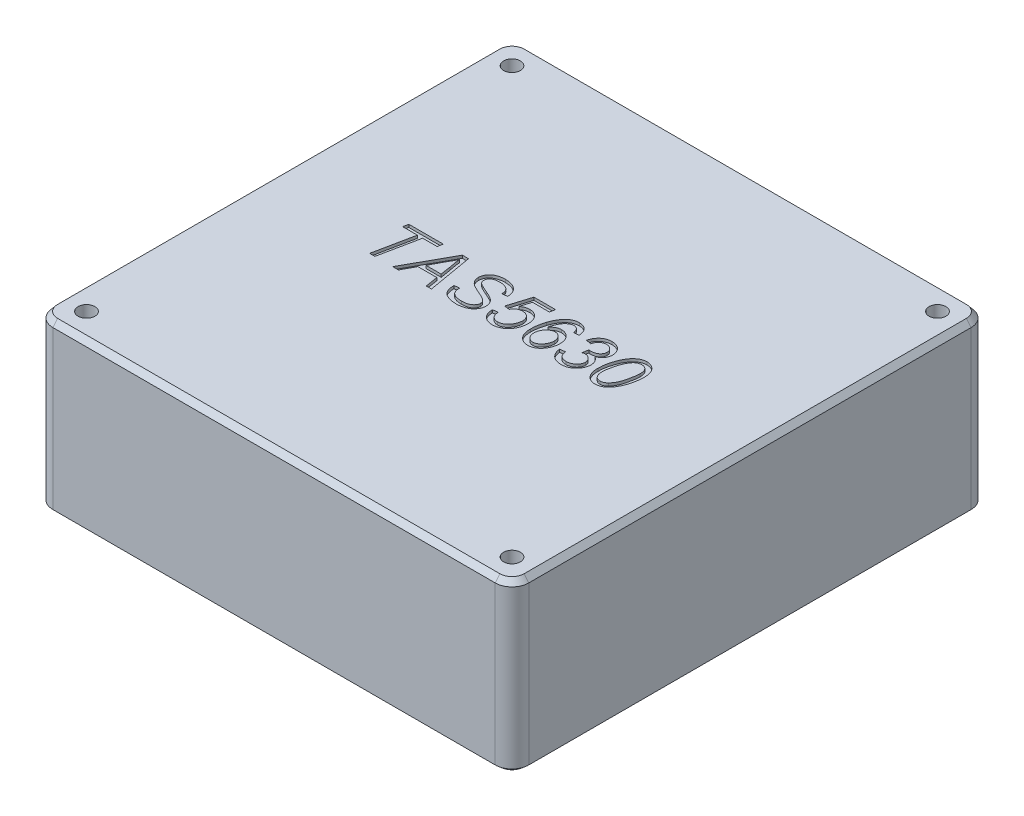
from build123d import *
from OCP.BRepFilletAPI import BRepFilletAPI_MakeChamfer

# Parameters (mm, degrees)
SKETCH_1_W          = 85
SKETCH_1_H          = 85
SKETCH_1_R          = 1.5
EXTRUDE_1_DEPTH     = 30
CUT_EXTRUDE_START   = 30
CUT_EXTRUDE_1_DEPTH = 0.5
FILLET_1_R          = 3
CHAMFER_1_SIZE      = 1
CHAMFER_1_SIZE2     = 0.839099631


with BuildPart() as part:
    # Эскиз1 → Бобышка-Вытянуть1 (new body)
    with BuildSketch(Plane(origin=(0, 0, 0), x_dir=(1, 0, 0), z_dir=(0, 1, 0))):
        Rectangle(SKETCH_1_W, SKETCH_1_H)
        with Locations(Location((-38, 38, 0), (0, 0, 270))):
            Circle(SKETCH_1_R, mode=Mode.SUBTRACT)
        with Locations(Location((-38, -38, 0), (0, 0, 270))):
            Circle(SKETCH_1_R, mode=Mode.SUBTRACT)
        with Locations(Location((38, -38, 0), (0, 0, 270))):
            Circle(SKETCH_1_R, mode=Mode.SUBTRACT)
        with Locations(Location((38, 38, 0), (0, 0, 270))):
            Circle(SKETCH_1_R, mode=Mode.SUBTRACT)
    extrude(amount=EXTRUDE_1_DEPTH)

    # Эскиз2 → Вырез-Вытянуть1 (cut)
    # profile 1 of 7: a face of its own
    with BuildSketch(Plane(origin=(0, 0, 0), x_dir=(1, 0, 0), z_dir=(0, 1, 0)).offset(CUT_EXTRUDE_START)):
        Polygon((-21.692433963, -3.73177485), (-20.245318578, 3.345148227), (-22.876728835, 3.345148227), (-22.687626271, 4.26822515), (-16.536985245, 4.26822515), (-16.727690373, 3.345148227), (-19.306216014, 3.345148227), (-20.753331399, -3.73177485), align=None)
    # profile 2 of 7: a face of its own
    with BuildSketch(Plane(origin=(0, 0, 0), x_dir=(1, 0, 0), z_dir=(0, 1, 0)).offset(CUT_EXTRUDE_START)):
        Polygon((-17.578651912, -3.73177485), (-13.137946783, 4.26822515), (-12.036985245, 4.26822515), (-10.657177553, -3.73177485), (-11.58986986, -3.73177485), (-11.950446783, -1.475364594), (-15.325446783, -1.475364594), (-16.544998065, -3.73177485), align=None)
        with BuildLine():
            Line((-14.798203194, -0.552287671), (-12.096280117, -0.552287671))
            Line((-12.096280117, -0.552287671), (-12.403972424, 1.37399438))
            add(Edge.make_bspline(
                [(-12.403972424, 1.37399438), (-12.424786211, 1.470580235), (-12.465420433, 1.659142325), (-12.516328002, 1.937092947), (-12.568392425, 2.201347782), (-12.608031686, 2.454032483), (-12.647325874, 2.693944928), (-12.673630929, 2.92208113), (-12.701860341, 3.137460723), (-12.712773744, 3.277246523), (-12.718074988, 3.345148227)],
                knots=[0, 0, 0, 0, 1.187075157, 2.317496411, 3.39507795, 4.42283965, 5.390522706, 6.315610667, 7.18179882, 8, 8, 8, 8], degree=3))
            add(Edge.make_bspline(
                [(-12.718074988, 3.345148227), (-12.772104137, 3.22714588), (-12.886019797, 2.978348416), (-13.086977698, 2.595261344), (-13.32085901, 2.181061113), (-13.492420184, 1.897051782), (-13.58185704, 1.74899438)],
                knots=[0, 0, 0, 0, 0.85739934, 1.807750339, 2.857154497, 4, 4, 4, 4], degree=3))
            Line((-13.58185704, 1.74899438), (-14.798203194, -0.552287671))
        make_face(mode=Mode.SUBTRACT)
    # profile 3 of 7: a face of its own
    with BuildSketch(Plane(origin=(0, 0, 0), x_dir=(1, 0, 0), z_dir=(0, 1, 0)).offset(CUT_EXTRUDE_START)):
        with BuildLine():
            Line((-9.17961345, -1.167672286), (-8.256536527, -1.065108184))
            Line((-8.256536527, -1.065108184), (-8.267754476, -1.331133825))
            add(Edge.make_bspline(
                [(-8.267754476, -1.331133825), (-8.26490623, -1.40344325), (-8.259267109, -1.546605668), (-8.216634657, -1.756013562), (-8.146374843, -1.95562868), (-8.051278453, -2.146028766), (-7.921849914, -2.322387836), (-7.75244273, -2.475728252), (-7.548663888, -2.609195471), (-7.309775221, -2.718095952), (-7.042645916, -2.805640766), (-6.749247025, -2.867274022), (-6.432157728, -2.904110478), (-6.212836102, -2.908825295), (-6.099485245, -2.91126203)],
                knots=[0, 0, 0, 0, 0.858275681, 1.699264264, 2.525822281, 3.365565876, 4.218149606, 5.107011874, 6.064126396, 7.09998594, 8.215326971, 9.396056326, 10.654217318, 12, 12, 12, 12], degree=3))
            add(Edge.make_bspline(
                [(-6.099485245, -2.91126203), (-6.018782176, -2.91010858), (-5.861942354, -2.907866944), (-5.633917733, -2.888352374), (-5.420720033, -2.856961826), (-5.222335603, -2.812337484), (-5.039276373, -2.754293148), (-4.86938773, -2.686136802), (-4.715035335, -2.602849546), (-4.577232482, -2.505891029), (-4.454784366, -2.402019461), (-4.345784586, -2.295184608), (-4.256490691, -2.182247001), (-4.180902729, -2.067650349), (-4.122801816, -1.948046175), (-4.080956386, -1.824855464), (-4.055903232, -1.6975304), (-4.052917317, -1.611693025), (-4.051408322, -1.568313312)],
                knots=[0, 0, 0, 0, 1.425731279, 2.770792289, 4.04024254, 5.230893421, 6.3592722, 7.430212247, 8.460708778, 9.450459374, 10.401561135, 11.295891975, 12.14200498, 12.940503131, 13.717227411, 14.484314755, 15.234016756, 16, 16, 16, 16], degree=3))
            add(Edge.make_bspline(
                [(-4.051408322, -1.568313312), (-4.054760166, -1.508068195), (-4.061409828, -1.388549044), (-4.116632341, -1.214936965), (-4.201552611, -1.048011507), (-4.283269801, -0.950416261), (-4.325446783, -0.900044081)],
                knots=[0, 0, 0, 0, 0.976847459, 1.937949255, 2.935706458, 4, 4, 4, 4], degree=3))
            add(Edge.make_bspline(
                [(-4.325446783, -0.900044081), (-4.353237787, -0.873261871), (-4.415680758, -0.813085537), (-4.532812341, -0.728179073), (-4.679126919, -0.635537122), (-4.85600845, -0.536719863), (-5.06270673, -0.431673636), (-5.299607068, -0.319307817), (-5.566225693, -0.199621651), (-5.755302653, -0.11974678), (-5.854292937, -0.077928696)],
                knots=[0, 0, 0, 0, 0.53058602, 1.192161577, 1.98540538, 2.9135926, 3.978754358, 5.17558752, 6.521293165, 8, 8, 8, 8], degree=3))
            add(Edge.make_bspline(
                [(-5.854292937, -0.077928696), (-5.931872122, -0.045626286), (-6.081007909, 0.016470852), (-6.293992177, 0.110486968), (-6.489468199, 0.195314098), (-6.66357543, 0.278394714), (-6.820103327, 0.350985617), (-6.955811569, 0.42044299), (-7.073723214, 0.48193986), (-7.144000057, 0.524321721), (-7.176408322, 0.543866175)],
                knots=[0, 0, 0, 0, 1.379339666, 2.651599208, 3.821445283, 4.876640935, 5.817965058, 6.653218182, 7.378929685, 8, 8, 8, 8], degree=3))
            add(Edge.make_bspline(
                [(-7.176408322, 0.543866175), (-7.264432037, 0.601715282), (-7.433607392, 0.712897173), (-7.654232402, 0.905215341), (-7.845968548, 1.097511681), (-7.996836056, 1.30458034), (-8.114644725, 1.521453508), (-8.19671198, 1.752842503), (-8.248265879, 1.99831358), (-8.253743975, 2.167537377), (-8.256536527, 2.253802073)],
                knots=[0, 0, 0, 0, 1.190296613, 2.28766591, 3.304920813, 4.256269293, 5.175634749, 6.087520294, 7.025081087, 8, 8, 8, 8], degree=3))
            add(Edge.make_bspline(
                [(-8.256536527, 2.253802073), (-8.252534553, 2.353474802), (-8.244646951, 2.549922564), (-8.181834848, 2.837029075), (-8.078514464, 3.108591872), (-7.958783554, 3.320339048), (-7.844825334, 3.479353008), (-7.748416104, 3.59210024), (-7.641079011, 3.696280567), (-7.527059063, 3.796385397), (-7.400535341, 3.885128002), (-7.267366019, 3.970105015), (-7.122711694, 4.04400481), (-6.918123425, 4.137378564), (-6.643970023, 4.231599522), (-6.296731656, 4.313380342), (-5.928856121, 4.362061196), (-5.677089881, 4.367833987), (-5.548203194, 4.370789252)],
                knots=[0, 0, 0, 0, 1.238475896, 2.440946701, 3.635078099, 4.839601842, 5.453463916, 6.065850834, 6.681148677, 7.312269075, 7.950065238, 8.600634686, 9.275045789, 9.967691431, 11.396165333, 12.870345012, 14.397835766, 16, 16, 16, 16], degree=3))
            add(Edge.make_bspline(
                [(-5.548203194, 4.370789252), (-5.470711169, 4.370081603), (-5.319290555, 4.368698846), (-5.096880246, 4.351566096), (-4.883275647, 4.32686673), (-4.678988934, 4.289811004), (-4.483408201, 4.24366093), (-4.29789283, 4.185652412), (-4.120660162, 4.118982996), (-3.95428585, 4.039780318), (-3.797539912, 3.953539252), (-3.650732343, 3.860762731), (-3.516146353, 3.759492052), (-3.392316073, 3.651973478), (-3.279127055, 3.537871959), (-3.178357108, 3.41573479), (-3.088000097, 3.28729107), (-2.98556536, 3.109561245), (-2.881046428, 2.885623491), (-2.788471013, 2.617215987), (-2.728081934, 2.354784858), (-2.721360237, 2.180386113), (-2.718074988, 2.095148227)],
                knots=[0, 0, 0, 0, 1.143512507, 2.234441106, 3.290654609, 4.316047515, 5.297102877, 6.254749841, 7.183126598, 8.089581974, 8.971812638, 9.822656227, 10.650539834, 11.455310542, 12.241441721, 13.019784509, 13.789735541, 14.55649065, 16.045011508, 17.428866519, 18.743351145, 20, 20, 20, 20], degree=3))
            add(Edge.make_bspline(
                [(-2.718074988, 2.095148227), (-2.718074988, 2.072712329), (-2.718074988, 2.017156774), (-2.718074988, 1.961601218), (-2.718074988, 1.92848156)],
                knots=[0, 0, 0, 0, 0.807692308, 2, 2, 2, 2], degree=3))
            Line((-2.718074988, 1.92848156), (-3.641151912, 1.845148227))
            add(Edge.make_bspline(
                [(-3.641151912, 1.845148227), (-3.641547466, 1.898596315), (-3.64229608, 1.999750567), (-3.653559046, 2.142104068), (-3.670999795, 2.266400925), (-3.692223231, 2.341040158), (-3.702049347, 2.375596945)],
                knots=[0, 0, 0, 0, 1.196373472, 2.264220624, 3.196361544, 4, 4, 4, 4], degree=3))
            add(Edge.make_bspline(
                [(-3.702049347, 2.375596945), (-3.721577709, 2.429568872), (-3.760070316, 2.535953642), (-3.839475609, 2.683720998), (-3.933852598, 2.817976409), (-4.041500799, 2.942239515), (-4.171045548, 3.051663484), (-4.319045599, 3.152142703), (-4.490967686, 3.237912627), (-4.68193599, 3.312262626), (-4.889802758, 3.373413909), (-5.111545803, 3.41526658), (-5.344977617, 3.444353543), (-5.504839372, 3.446575182), (-5.586664732, 3.447712329)],
                knots=[0, 0, 0, 0, 0.88689608, 1.748172411, 2.584840347, 3.421997753, 4.283274084, 5.199961756, 6.182923366, 7.247800225, 8.366915099, 9.5288022, 10.735115532, 12, 12, 12, 12], degree=3))
            add(Edge.make_bspline(
                [(-5.586664732, 3.447712329), (-5.658277679, 3.446391193), (-5.797454199, 3.443823626), (-5.999951885, 3.426596834), (-6.189945472, 3.395843656), (-6.367910553, 3.354661304), (-6.534436486, 3.301917028), (-6.68863607, 3.236322961), (-6.830758484, 3.158188168), (-6.916334005, 3.095539221), (-6.958459604, 3.064699509)],
                knots=[0, 0, 0, 0, 1.185078943, 2.303147281, 3.3596952, 4.367486573, 5.323590023, 6.246379327, 7.136758724, 8, 8, 8, 8], degree=3))
            add(Edge.make_bspline(
                [(-6.958459604, 3.064699509), (-6.988564248, 3.040361592), (-7.047528416, 2.992692367), (-7.122666983, 2.908811907), (-7.189966932, 2.82194049), (-7.240025415, 2.725398363), (-7.283448743, 2.625949975), (-7.311430036, 2.518894439), (-7.329608386, 2.406667185), (-7.332162556, 2.329730646), (-7.333459604, 2.290661047)],
                knots=[0, 0, 0, 0, 1.039030166, 2.035086348, 3.020315512, 3.984274806, 4.949837582, 5.932341348, 6.950010026, 8, 8, 8, 8], degree=3))
            add(Edge.make_bspline(
                [(-7.333459604, 2.290661047), (-7.331710899, 2.244026582), (-7.328278745, 2.152497906), (-7.298121919, 2.019032969), (-7.249897337, 1.893086094), (-7.181069572, 1.772464556), (-7.084232684, 1.6575501), (-6.957642626, 1.546274419), (-6.801104114, 1.435482962), (-6.682976237, 1.369126973), (-6.620318578, 1.333930278)],
                knots=[0, 0, 0, 0, 0.885166844, 1.737301987, 2.585559362, 3.440410528, 4.36313212, 5.426921844, 6.635181999, 8, 8, 8, 8], degree=3))
            add(Edge.make_bspline(
                [(-6.620318578, 1.333930278), (-6.592012538, 1.319497105), (-6.527526866, 1.286616037), (-6.419245151, 1.231745942), (-6.284801112, 1.170031542), (-6.127105484, 1.095281331), (-5.942472228, 1.015591422), (-5.736021783, 0.920680336), (-5.502643808, 0.820922019), (-5.339285712, 0.749641275), (-5.253331399, 0.712135406)],
                knots=[0, 0, 0, 0, 0.507694923, 1.156609942, 1.939357829, 2.871124938, 3.94489054, 5.152129338, 6.501532703, 8, 8, 8, 8], degree=3))
            add(Edge.make_bspline(
                [(-5.253331399, 0.712135406), (-5.183352539, 0.681153495), (-5.048651902, 0.621517152), (-4.854730771, 0.535644452), (-4.678371946, 0.454008343), (-4.519324065, 0.376749364), (-4.376853902, 0.305291191), (-4.251445851, 0.237653536), (-4.142827988, 0.175877615), (-4.076937502, 0.134864537), (-4.04660063, 0.11598156)],
                knots=[0, 0, 0, 0, 1.363402043, 2.62438005, 3.778247165, 4.825290736, 5.77437896, 6.617445503, 7.363453188, 8, 8, 8, 8], degree=3))
            add(Edge.make_bspline(
                [(-4.04660063, 0.11598156), (-3.975880755, 0.067415447), (-3.837135828, -0.027866139), (-3.654179957, -0.196495497), (-3.494986103, -0.378483297), (-3.362866857, -0.576656247), (-3.257911376, -0.789318411), (-3.181889232, -1.016028824), (-3.13579428, -1.25714767), (-3.130854354, -1.422808401), (-3.128331399, -1.507415876)],
                knots=[0, 0, 0, 0, 1.054714124, 2.069237773, 3.052629045, 4.024524991, 4.991873927, 5.962790947, 6.959541516, 8, 8, 8, 8], degree=3))
            add(Edge.make_bspline(
                [(-3.128331399, -1.507415876), (-3.129672892, -1.560878367), (-3.132322928, -1.666490158), (-3.150203377, -1.823615064), (-3.180937059, -1.976677875), (-3.222131786, -2.127846941), (-3.279549988, -2.274156518), (-3.344555221, -2.419603832), (-3.423711805, -2.560927532), (-3.514762773, -2.697653485), (-3.615833689, -2.829961437), (-3.727947405, -2.954135104), (-3.848391387, -3.071363668), (-3.977249563, -3.181534591), (-4.116953136, -3.282232616), (-4.266515512, -3.374592836), (-4.42371247, -3.46194146), (-4.647428219, -3.56682495), (-4.946408429, -3.675871188), (-5.327934674, -3.768469268), (-5.734652752, -3.823198), (-6.013845248, -3.830559628), (-6.157177553, -3.834338953)],
                knots=[0, 0, 0, 0, 0.753323331, 1.488142895, 2.22477222, 2.951645461, 3.692569589, 4.437003057, 5.195162042, 5.9717794, 6.750145735, 7.539032231, 8.32684067, 9.11716229, 9.925698599, 10.750710093, 11.592951182, 12.45831893, 14.230046657, 16.066640586, 17.980685438, 20, 20, 20, 20], degree=3))
            add(Edge.make_bspline(
                [(-6.157177553, -3.834338953), (-6.265682016, -3.832486939), (-6.477700105, -3.828868098), (-6.788074025, -3.80078374), (-7.083955018, -3.757214261), (-7.364097135, -3.692069974), (-7.630578695, -3.613868076), (-7.879179093, -3.510967767), (-8.114515056, -3.39477971), (-8.334068341, -3.259151795), (-8.533394745, -3.098683653), (-8.707330322, -2.908376887), (-8.853862464, -2.688311308), (-8.971959147, -2.438934065), (-9.065190558, -2.161915191), (-9.131530021, -1.856176814), (-9.171351831, -1.52128059), (-9.176790165, -1.28851263), (-9.17961345, -1.167672286)],
                knots=[0, 0, 0, 0, 1.125067994, 2.198386657, 3.229442192, 4.223907366, 5.179018808, 6.105903256, 7.010179201, 7.898637484, 8.776811776, 9.655143314, 10.561656395, 11.508166035, 12.508477435, 13.586446658, 14.74701564, 16, 16, 16, 16], degree=3))
        make_face()
    # profile 4 of 7: a face of its own
    with BuildSketch(Plane(origin=(0, 0, 0), x_dir=(1, 0, 0), z_dir=(0, 1, 0)).offset(CUT_EXTRUDE_START)):
        with BuildLine():
            Line((-1.995318578, -1.475364594), (-1.065831399, -1.372800491))
            add(Edge.make_bspline(
                [(-1.065831399, -1.372800491), (-1.067603031, -1.401104381), (-1.070744608, -1.451294733), (-1.072785308, -1.517616579), (-1.077553546, -1.565055073), (-1.077186717, -1.590744431), (-1.077049347, -1.600364594)],
                knots=[0, 0, 0, 0, 1.49324247, 2.647917546, 3.493671534, 4, 4, 4, 4], degree=3))
            add(Edge.make_bspline(
                [(-1.077049347, -1.600364594), (-1.075140838, -1.654013751), (-1.071278771, -1.762578422), (-1.030951524, -1.924378949), (-0.971939547, -2.087195656), (-0.889037798, -2.24714482), (-0.786572823, -2.398082923), (-0.664674475, -2.532807508), (-0.526451029, -2.649752238), (-0.369933963, -2.7428498), (-0.204558914, -2.818502114), (-0.031962092, -2.870894121), (0.144921983, -2.904750629), (0.26467641, -2.909076137), (0.325194242, -2.91126203)],
                knots=[0, 0, 0, 0, 0.906627297, 1.834654978, 2.807478465, 3.834894577, 4.87595349, 5.887685388, 6.902081762, 7.928900597, 8.961082484, 9.973784094, 10.976052945, 12, 12, 12, 12], degree=3))
            add(Edge.make_bspline(
                [(0.325194242, -2.91126203), (0.405683949, -2.907591997), (0.569331284, -2.900130284), (0.813701678, -2.836500888), (1.059705696, -2.737342402), (1.304806075, -2.599908042), (1.541163337, -2.425468148), (1.755753549, -2.211148562), (1.946434661, -1.961605196), (2.10755143, -1.680794413), (2.2404737, -1.3849168), (2.338058194, -1.084246564), (2.398693688, -0.784431173), (2.406345637, -0.584073121), (2.41013014, -0.484979979)],
                knots=[0, 0, 0, 0, 0.823456648, 1.674207695, 2.570467732, 3.535691777, 4.544780077, 5.570191462, 6.631860066, 7.75250498, 8.879305647, 9.948786735, 10.985510363, 12, 12, 12, 12], degree=3))
            add(Edge.make_bspline(
                [(2.41013014, -0.484979979), (2.40897357, -0.430433627), (2.406720837, -0.324189749), (2.387028759, -0.169147836), (2.355045686, -0.022688851), (2.310695586, 0.116430666), (2.25018837, 0.246015897), (2.180608735, 0.369455084), (2.094070433, 0.481319232), (1.998168547, 0.58604852), (1.891269489, 0.680095496), (1.775282545, 0.762316812), (1.651203468, 0.831761552), (1.518666416, 0.887407019), (1.379145573, 0.933447953), (1.229976549, 0.962585363), (1.073610484, 0.982772255), (0.966288128, 0.985027469), (0.911732704, 0.986173868)],
                knots=[0, 0, 0, 0, 1.106111206, 2.154452896, 3.164053986, 4.144088983, 5.109031686, 6.06061856, 7.012020331, 7.970553412, 8.937926705, 9.894006722, 10.849656805, 11.815754801, 12.806099026, 13.824039282, 14.893888794, 16, 16, 16, 16], degree=3))
            add(Edge.make_bspline(
                [(0.911732704, 0.986173868), (0.837320451, 0.983167867), (0.690087349, 0.977220152), (0.47135249, 0.936426331), (0.260563357, 0.864579457), (0.055791846, 0.769625111), (-0.134790703, 0.643672612), (-0.301949009, 0.481270065), (-0.44678861, 0.287253831), (-0.519039676, 0.139250924), (-0.556216014, 0.063096945)],
                knots=[0, 0, 0, 0, 0.97081602, 1.920869877, 2.890634552, 3.869597423, 4.85931845, 5.855033763, 6.89632091, 8, 8, 8, 8], degree=3))
            Line((-0.556216014, 0.063096945), (-1.487305758, 0.165661047))
            Line((-1.487305758, 0.165661047), (-0.251728835, 4.165661047))
            Line((-0.251728835, 4.165661047), (3.615258345, 4.165661047))
            Line((3.615258345, 4.165661047), (3.424553217, 3.242584124))
            Line((3.424553217, 3.242584124), (0.424553217, 3.242584124))
            Line((0.424553217, 3.242584124), (-0.150767296, 1.382007201))
            add(Edge.make_bspline(
                [(-0.150767296, 1.382007201), (-0.095308903, 1.424043474), (0.013920489, 1.506837011), (0.186009269, 1.613528875), (0.358923174, 1.705922098), (0.535008756, 1.780020092), (0.713514, 1.838019164), (0.894646797, 1.879976206), (1.078252572, 1.904542326), (1.201191238, 1.907680729), (1.262694242, 1.909250791)],
                knots=[0, 0, 0, 0, 1.08549606, 2.137964479, 3.156027519, 4.142328905, 5.115149779, 6.081807146, 7.040378209, 8, 8, 8, 8], degree=3))
            add(Edge.make_bspline(
                [(1.262694242, 1.909250791), (1.336491709, 1.907407776), (1.481464095, 1.903787243), (1.69388443, 1.87519425), (1.895573025, 1.823901364), (2.08865143, 1.758599865), (2.269629101, 1.667845856), (2.442347854, 1.561360068), (2.602193189, 1.431165847), (2.753550239, 1.286287943), (2.888799006, 1.122928321), (3.008904944, 0.945220408), (3.110080199, 0.752316077), (3.191083806, 0.544478798), (3.256341546, 0.323264737), (3.299643153, 0.087426926), (3.327843792, -0.162717548), (3.331385549, -0.334257531), (3.333207063, -0.422479979)],
                knots=[0, 0, 0, 0, 1.009083946, 1.982307972, 2.923133173, 3.851912484, 4.763437245, 5.685700749, 6.62123574, 7.577002532, 8.546958346, 9.51545502, 10.505559142, 11.51891788, 12.561530472, 13.654716952, 14.793828665, 16, 16, 16, 16], degree=3))
            add(Edge.make_bspline(
                [(3.333207063, -0.422479979), (3.331983796, -0.501042439), (3.329558518, -0.656802227), (3.309914678, -0.887997704), (3.277320069, -1.114095989), (3.235246768, -1.336146162), (3.176226318, -1.55229163), (3.108046947, -1.765360887), (3.024256705, -1.972503954), (2.930159196, -2.174503599), (2.824813572, -2.3678024), (2.709221579, -2.550877518), (2.584667554, -2.722829326), (2.448604809, -2.88197254), (2.305231771, -3.031496603), (2.150326229, -3.167962244), (1.98652935, -3.293358756), (1.813946865, -3.406685106), (1.63545035, -3.506956674), (1.452965893, -3.594440791), (1.26699698, -3.667799965), (1.077320044, -3.729726008), (0.883597211, -3.775348843), (0.686699558, -3.809282403), (0.486477588, -3.831095851), (0.351424952, -3.833253966), (0.283527576, -3.834338953)],
                knots=[0, 0, 0, 0, 1.107778984, 2.196308754, 3.269111178, 4.328392579, 5.380902249, 6.426704866, 7.481449709, 8.529528877, 9.567816257, 10.583531577, 11.581009243, 12.559068588, 13.533989767, 14.499905363, 15.467200609, 16.440840376, 17.408868676, 18.35231528, 19.292357287, 20.226221515, 21.16354305, 22.096099876, 23.042818958, 24, 24, 24, 24], degree=3))
            add(Edge.make_bspline(
                [(0.283527576, -3.834338953), (0.17163825, -3.830694377), (-0.047191569, -3.823566425), (-0.365677694, -3.766269696), (-0.664792217, -3.672153088), (-0.940184623, -3.538439367), (-1.190572658, -3.373812573), (-1.407676065, -3.176656636), (-1.594435378, -2.952891259), (-1.740611618, -2.701390425), (-1.854214172, -2.437228292), (-1.938802707, -2.170116171), (-1.991017614, -1.902086561), (-1.997105605, -1.722916745), (-2.000126271, -1.63401844)],
                knots=[0, 0, 0, 0, 1.134559216, 2.218937215, 3.271314431, 4.306342073, 5.314938747, 6.301080251, 7.271171215, 8.260123367, 9.240754197, 10.183513153, 11.098717604, 12, 12, 12, 12], degree=3))
            add(Edge.make_bspline(
                [(-2.000126271, -1.63401844), (-1.9996378, -1.612115385), (-1.998458116, -1.559218322), (-1.996478497, -1.506344805), (-1.995318578, -1.475364594)],
                knots=[0, 0, 0, 0, 0.828138796, 2, 2, 2, 2], degree=3))
        make_face()
    # profile 5 of 7: a face of its own
    with BuildSketch(Plane(origin=(0, 0, 0), x_dir=(1, 0, 0), z_dir=(0, 1, 0)).offset(CUT_EXTRUDE_START)):
        with BuildLine():
            add(Edge.make_bspline(
                [(5.618463473, 0.798673868), (5.684737247, 0.862871641), (5.813546539, 0.987646032), (6.01762152, 1.149696), (6.218551403, 1.290463766), (6.421484454, 1.40264113), (6.623372006, 1.491953122), (6.824885642, 1.555009783), (7.025636324, 1.593644038), (7.159433115, 1.598933413), (7.225835268, 1.601558483)],
                knots=[0, 0, 0, 0, 1.200695668, 2.333664572, 3.388991219, 4.391540616, 5.347781268, 6.258546035, 7.135731947, 8, 8, 8, 8], degree=3))
            add(Edge.make_bspline(
                [(7.225835268, 1.601558483), (7.298586759, 1.599793479), (7.441475344, 1.596326897), (7.650801297, 1.566587952), (7.85141759, 1.518954463), (8.041327328, 1.449856861), (8.222273826, 1.362514091), (8.391683493, 1.254249938), (8.553707347, 1.128736761), (8.703181301, 0.983262401), (8.839177519, 0.821801387), (8.95859623, 0.646579173), (9.058534606, 0.457163067), (9.139910991, 0.254537435), (9.204820015, 0.038545027), (9.248422351, -0.191366745), (9.276433618, -0.434076545), (9.280066675, -0.600284084), (9.281925012, -0.685300491)],
                knots=[0, 0, 0, 0, 1.009933029, 1.983573098, 2.930039649, 3.86874025, 4.784499183, 5.714807186, 6.655674675, 7.626285778, 8.605618543, 9.583010502, 10.56534534, 11.573778596, 12.611238794, 13.692267209, 14.819577305, 16, 16, 16, 16], degree=3))
            add(Edge.make_bspline(
                [(9.281925012, -0.685300491), (9.279819632, -0.796020554), (9.275664482, -1.014536209), (9.231997816, -1.335622029), (9.165113961, -1.644497899), (9.072405751, -1.941889826), (8.949173016, -2.226028506), (8.801691929, -2.499602563), (8.626473286, -2.761341947), (8.490240037, -2.922642491), (8.421348088, -3.004210748)],
                knots=[0, 0, 0, 0, 1.049391632, 2.071065482, 3.06668699, 4.04399474, 5.01979151, 5.998987983, 6.988105935, 8, 8, 8, 8], degree=3))
            add(Edge.make_bspline(
                [(8.421348088, -3.004210748), (8.358940331, -3.070034421), (8.236264358, -3.199425118), (8.035171086, -3.37023806), (7.822918809, -3.513883369), (7.599716768, -3.629573357), (7.368029964, -3.721891252), (7.126273237, -3.787895668), (6.874033319, -3.827225468), (6.702471628, -3.83194154), (6.615258345, -3.834338953)],
                knots=[0, 0, 0, 0, 1.060809501, 2.085251007, 3.080363607, 4.053300922, 5.021346797, 5.993339951, 6.979915562, 8, 8, 8, 8], degree=3))
            add(Edge.make_bspline(
                [(6.615258345, -3.834338953), (6.536066797, -3.832298604), (6.380682242, -3.828295164), (6.153008445, -3.793334817), (5.934876791, -3.738075294), (5.727751364, -3.6563425), (5.528684806, -3.556123661), (5.34269661, -3.429006886), (5.164714407, -3.282456323), (4.998684885, -3.113184644), (4.848406849, -2.922402694), (4.715376835, -2.712581523), (4.60506475, -2.482089648), (4.515967051, -2.232565465), (4.445163355, -1.964520408), (4.394620357, -1.677791038), (4.363541898, -1.371351563), (4.360444504, -1.160804752), (4.358848088, -1.052287671)],
                knots=[0, 0, 0, 0, 0.942860109, 1.850019387, 2.737502558, 3.61790783, 4.497323638, 5.386857741, 6.295332923, 7.240316618, 8.205335733, 9.183421727, 10.193806392, 11.242559355, 12.335388921, 13.492525404, 14.707632651, 16, 16, 16, 16], degree=3))
            add(Edge.make_bspline(
                [(4.358848088, -1.052287671), (4.36013038, -0.952367495), (4.36271099, -0.751278271), (4.382290686, -0.448035782), (4.416164405, -0.142275399), (4.463236359, 0.165455955), (4.520557449, 0.476311875), (4.592594159, 0.78966619), (4.679500258, 1.105230903), (4.745490753, 1.314894071), (4.778719883, 1.420468739)],
                knots=[0, 0, 0, 0, 0.952095218, 1.916090397, 2.894187682, 3.882601748, 4.881965216, 5.905612615, 6.945383416, 8, 8, 8, 8], degree=3))
            add(Edge.make_bspline(
                [(4.778719883, 1.420468739), (4.805886073, 1.500818471), (4.859269536, 1.658711318), (4.948320137, 1.887457607), (5.038570764, 2.106499263), (5.137298426, 2.313283099), (5.239045622, 2.51050046), (5.346920516, 2.696003936), (5.456828431, 2.872097004), (5.611261948, 3.085732699), (5.808825544, 3.329145221), (6.057550991, 3.586470688), (6.314251482, 3.801318897), (6.580471172, 3.975145184), (6.861254697, 4.106573356), (7.156553955, 4.201841156), (7.470586373, 4.256957877), (7.685022008, 4.264411329), (7.794745524, 4.26822515)],
                knots=[0, 0, 0, 0, 0.914361304, 1.796783966, 2.646087261, 3.467938699, 4.266514742, 5.038048324, 5.781043274, 6.503461799, 7.878831833, 9.157721235, 10.356038674, 11.480715885, 12.575698483, 13.688589951, 14.817285955, 16, 16, 16, 16], degree=3))
            add(Edge.make_bspline(
                [(7.794745524, 4.26822515), (7.860538366, 4.266807595), (7.989374806, 4.264031719), (8.177422749, 4.238736647), (8.357153561, 4.201415797), (8.526475531, 4.144799391), (8.687213299, 4.073882659), (8.838481306, 3.986597236), (8.981553736, 3.884418499), (9.113055828, 3.764932806), (9.233397782, 3.631863317), (9.341392882, 3.484844309), (9.436826502, 3.324453952), (9.514336284, 3.148312186), (9.580187456, 2.960215809), (9.633235585, 2.758865706), (9.671856904, 2.543944928), (9.685299625, 2.395500877), (9.692181422, 2.319507201)],
                knots=[0, 0, 0, 0, 1.038974951, 2.034534943, 2.99302097, 3.935166265, 4.849532095, 5.764482023, 6.689690209, 7.621916509, 8.566063278, 9.519818403, 10.499765183, 11.508404633, 12.554757984, 13.645900893, 14.794854735, 16, 16, 16, 16], degree=3))
            Line((9.692181422, 2.319507201), (8.783527576, 2.216943098))
            add(Edge.make_bspline(
                [(8.783527576, 2.216943098), (8.776669912, 2.265129735), (8.763417848, 2.358247799), (8.734014522, 2.491944039), (8.699664123, 2.616155917), (8.655827998, 2.729185148), (8.608640449, 2.833193486), (8.551884144, 2.925579161), (8.487505966, 3.006981153), (8.396594318, 3.102724049), (8.268389864, 3.201137718), (8.096078464, 3.285076659), (7.907262417, 3.337225774), (7.775859702, 3.342455635), (7.708207063, 3.345148227)],
                knots=[0, 0, 0, 0, 1.011972491, 1.955581984, 2.845325752, 3.689286488, 4.474604484, 5.217764483, 5.937894105, 6.62942907, 7.960560096, 9.272354343, 10.595672627, 12, 12, 12, 12], degree=3))
            add(Edge.make_bspline(
                [(7.708207063, 3.345148227), (7.634585047, 3.341079639), (7.484096447, 3.332763158), (7.260028031, 3.264204604), (7.037135278, 3.154048555), (6.814691579, 3.00487683), (6.599390345, 2.813624729), (6.400501419, 2.577692342), (6.216102106, 2.302311978), (6.054245985, 1.993833771), (5.911010148, 1.676373283), (5.789436154, 1.368590492), (5.688406136, 1.079642132), (5.641166605, 0.889875138), (5.618463473, 0.798673868)],
                knots=[0, 0, 0, 0, 0.752116403, 1.537379032, 2.375789422, 3.289827393, 4.269284654, 5.31202136, 6.438281417, 7.653520218, 8.871606912, 10.000171977, 11.038890526, 12, 12, 12, 12], degree=3))
        make_face()
        with BuildLine():
            add(Edge.make_bspline(
                [(5.281925012, -1.433697927), (5.28307808, -1.485046282), (5.285332669, -1.585447412), (5.305372137, -1.732950593), (5.337043852, -1.874163978), (5.382132779, -2.009464656), (5.439981689, -2.138421712), (5.51149381, -2.260929902), (5.594219803, -2.378168847), (5.690509388, -2.485977721), (5.793517146, -2.584517151), (5.901266961, -2.671310445), (6.011891472, -2.746680667), (6.128214743, -2.804386089), (6.245342987, -2.855373105), (6.367978849, -2.885028505), (6.492581251, -2.908388325), (6.577212615, -2.910296047), (6.620066037, -2.91126203)],
                knots=[0, 0, 0, 0, 1.115645133, 2.181414251, 3.229259285, 4.257361296, 5.275977796, 6.295652599, 7.336332245, 8.389311289, 9.432320239, 10.431493282, 11.394385528, 12.334321479, 13.250726252, 14.163224041, 15.06994131, 16, 16, 16, 16], degree=3))
            add(Edge.make_bspline(
                [(6.620066037, -2.91126203), (6.681829424, -2.90817378), (6.808871572, -2.901821507), (6.999432017, -2.847589211), (7.19551572, -2.766636727), (7.394502016, -2.653184094), (7.589313164, -2.506734372), (7.770951367, -2.324713427), (7.933382991, -2.107392473), (8.080341728, -1.864640936), (8.201668858, -1.604502362), (8.292843932, -1.339578974), (8.348382489, -1.073828752), (8.355380082, -0.896554844), (8.358848088, -0.808697927)],
                knots=[0, 0, 0, 0, 0.744895419, 1.532187919, 2.377038237, 3.304700537, 4.290722382, 5.312825505, 6.399538368, 7.560450902, 8.735428702, 9.859825838, 10.939330072, 12, 12, 12, 12], degree=3))
            add(Edge.make_bspline(
                [(8.358848088, -0.808697927), (8.357542269, -0.753631427), (8.354999746, -0.646413108), (8.337393298, -0.489762614), (8.307072832, -0.341638), (8.263825881, -0.20142014), (8.207608977, -0.070036408), (8.139963579, 0.053303459), (8.059174994, 0.167184725), (7.967954844, 0.272925919), (7.868427015, 0.367666563), (7.762690849, 0.450855617), (7.652197612, 0.521269668), (7.536230794, 0.580362242), (7.41382989, 0.622280041), (7.287634234, 0.655458425), (7.155922672, 0.674848022), (7.066174448, 0.677259752), (7.020707063, 0.67848156)],
                knots=[0, 0, 0, 0, 1.180671764, 2.298850316, 3.374874581, 4.418275999, 5.439499866, 6.434104276, 7.42877464, 8.427656938, 9.424172213, 10.370513635, 11.307870268, 12.229915467, 13.153737589, 14.076067326, 15.025315676, 16, 16, 16, 16], degree=3))
            add(Edge.make_bspline(
                [(7.020707063, 0.67848156), (6.96771406, 0.676510339), (6.86210379, 0.672581873), (6.704857882, 0.644498944), (6.550934901, 0.597345907), (6.398454089, 0.533511988), (6.251902554, 0.446753226), (6.106023918, 0.345847174), (5.965040449, 0.223838156), (5.826944907, 0.086952966), (5.699937484, -0.066042161), (5.586610022, -0.229227091), (5.493382529, -0.404527134), (5.416259139, -0.5896623), (5.354946885, -0.785882397), (5.31232863, -0.993090622), (5.28594068, -1.210254361), (5.283280035, -1.358300463), (5.281925012, -1.433697927)],
                knots=[0, 0, 0, 0, 0.84084176, 1.6757217, 2.525913989, 3.39197796, 4.292102683, 5.223464824, 6.203704774, 7.246783738, 8.306202932, 9.354985391, 10.394267689, 11.450731638, 12.534033357, 13.651366924, 14.803879492, 16, 16, 16, 16], degree=3))
        make_face(mode=Mode.SUBTRACT)
    # profile 6 of 7: a face of its own
    with BuildSketch(Plane(origin=(0, 0, 0), x_dir=(1, 0, 0), z_dir=(0, 1, 0)).offset(CUT_EXTRUDE_START)):
        with BuildLine():
            Line((10.102437832, -1.577928696), (11.025514755, -1.475364594))
            add(Edge.make_bspline(
                [(11.025514755, -1.475364594), (11.03526634, -1.537513366), (11.054140073, -1.65779939), (11.096853805, -1.829865262), (11.145633385, -1.989421281), (11.204949994, -2.135114714), (11.27193247, -2.267423999), (11.348002466, -2.38525658), (11.430878947, -2.490876531), (11.525407555, -2.580912052), (11.626569864, -2.659476038), (11.735040211, -2.728214636), (11.852447092, -2.783328859), (11.976231929, -2.829911527), (12.107311468, -2.867744203), (12.246503172, -2.891993794), (12.393142202, -2.909191869), (12.493409517, -2.910561031), (12.544745524, -2.91126203)],
                knots=[0, 0, 0, 0, 1.294426065, 2.505300711, 3.646088348, 4.726332612, 5.739452866, 6.694195637, 7.609559141, 8.49613314, 9.373796622, 10.243362574, 11.133611648, 12.038411762, 12.964348743, 13.937097054, 14.943811342, 16, 16, 16, 16], degree=3))
            add(Edge.make_bspline(
                [(12.544745524, -2.91126203), (12.606767322, -2.909579534), (12.729612362, -2.906247055), (12.910579664, -2.884081676), (13.085075381, -2.844592864), (13.253609106, -2.792779107), (13.414583946, -2.722685673), (13.56978879, -2.638886224), (13.718391187, -2.539641033), (13.858775483, -2.426297752), (13.986415419, -2.303047829), (14.100153071, -2.174646343), (14.194938069, -2.040443661), (14.274952205, -1.90290744), (14.333763943, -1.75894705), (14.377369259, -1.611943336), (14.406476597, -1.460483994), (14.408905551, -1.357442484), (14.41013014, -1.305492799)],
                knots=[0, 0, 0, 0, 1.094666222, 2.168178271, 3.211243268, 4.24892566, 5.275195374, 6.304535234, 7.358325136, 8.424359069, 9.484540223, 10.486752883, 11.446838671, 12.380022527, 13.288739249, 14.183656868, 15.084267561, 16, 16, 16, 16], degree=3))
            add(Edge.make_bspline(
                [(14.41013014, -1.305492799), (14.40875335, -1.26057958), (14.406054493, -1.172538277), (14.389131875, -1.043230446), (14.355897938, -0.920679344), (14.31284758, -0.803581857), (14.258573961, -0.691362293), (14.18860311, -0.58758484), (14.107794268, -0.488605367), (14.015048439, -0.396820428), (13.913587251, -0.310824162), (13.800001538, -0.240158706), (13.681265787, -0.175484993), (13.551320818, -0.127097076), (13.414523844, -0.086195068), (13.268242413, -0.060197569), (13.114694888, -0.041134644), (13.009019914, -0.040031204), (12.955001935, -0.039467158)],
                knots=[0, 0, 0, 0, 0.995499634, 1.951431809, 2.881733097, 3.803104256, 4.713689825, 5.636276914, 6.569961265, 7.540947269, 8.524622692, 9.509721668, 10.499928494, 11.515565199, 12.575756501, 13.659995629, 14.803857697, 16, 16, 16, 16], degree=3))
            add(Edge.make_bspline(
                [(12.955001935, -0.039467158), (12.938883788, -0.041139934), (12.899503134, -0.045226944), (12.831443075, -0.067591411), (12.742473413, -0.098763975), (12.677064638, -0.126626016), (12.64089937, -0.142031261)],
                knots=[0, 0, 0, 0, 0.584983048, 1.429259602, 2.578607939, 4, 4, 4, 4], degree=3))
            Line((12.64089937, -0.142031261), (12.809168601, 0.902840534))
            add(Edge.make_bspline(
                [(12.809168601, 0.902840534), (12.855052476, 0.897232224), (12.945007867, 0.886237124), (13.035612391, 0.884473709), (13.080001935, 0.883609765)],
                knots=[0, 0, 0, 0, 1.020147305, 2, 2, 2, 2], degree=3))
            add(Edge.make_bspline(
                [(13.080001935, 0.883609765), (13.147883285, 0.884881125), (13.279609499, 0.887348243), (13.471286682, 0.905224486), (13.651190374, 0.933950799), (13.819518683, 0.972714101), (13.974735332, 1.026538051), (14.118113729, 1.090571721), (14.250100575, 1.165645849), (14.369130542, 1.252563253), (14.474240236, 1.348374201), (14.566182338, 1.450089854), (14.645910695, 1.556069607), (14.709971065, 1.668036178), (14.759128122, 1.78608458), (14.793247249, 1.908880668), (14.817840711, 2.037024236), (14.819528069, 2.124407843), (14.82038655, 2.168866175)],
                knots=[0, 0, 0, 0, 1.344989644, 2.610001018, 3.810758888, 4.953276435, 6.027819718, 7.060679099, 8.061136458, 9.030825869, 9.974989578, 10.874297366, 11.744412807, 12.59782058, 13.423467791, 14.271145057, 15.120407015, 16, 16, 16, 16], degree=3))
            add(Edge.make_bspline(
                [(14.82038655, 2.168866175), (14.818841411, 2.209487973), (14.815800334, 2.289438034), (14.801082374, 2.407697625), (14.768750589, 2.51964047), (14.730336017, 2.628278058), (14.674983712, 2.729192089), (14.614152379, 2.828860343), (14.534772327, 2.918851201), (14.449928162, 3.00762486), (14.354408044, 3.085769816), (14.254267023, 3.157008989), (14.1466063, 3.213012565), (14.035390536, 3.262851326), (13.918281998, 3.298435302), (13.796418525, 3.326842587), (13.669099985, 3.342670287), (13.582178605, 3.344317413), (13.538335268, 3.345148227)],
                knots=[0, 0, 0, 0, 1.006415868, 1.980784109, 2.939958003, 3.885636602, 4.8261232, 5.783563509, 6.768996359, 7.788275121, 8.82110339, 9.818881085, 10.82468861, 11.81965813, 12.831791823, 13.848751795, 14.91490564, 16, 16, 16, 16], degree=3))
            add(Edge.make_bspline(
                [(13.538335268, 3.345148227), (13.452483644, 3.340659902), (13.282617186, 3.331779281), (13.034824574, 3.265854204), (12.802126049, 3.153658643), (12.622289757, 3.02769277), (12.489042811, 2.908335635), (12.398553983, 2.807283354), (12.31636029, 2.69832731), (12.24445403, 2.57939573), (12.181903656, 2.451529125), (12.12664995, 2.315452113), (12.084222013, 2.169017395), (12.062312569, 2.068041708), (12.051155781, 2.016622586)],
                knots=[0, 0, 0, 0, 1.422179699, 2.813931943, 4.216039858, 5.685001299, 6.437293795, 7.177079614, 7.929736807, 8.696635281, 9.476761924, 10.287398529, 11.127904274, 12, 12, 12, 12], degree=3))
            Line((12.051155781, 2.016622586), (11.128078858, 2.192904637))
            add(Edge.make_bspline(
                [(11.128078858, 2.192904637), (11.148901836, 2.273346342), (11.189839971, 2.431495345), (11.26842279, 2.658677726), (11.360011178, 2.872166874), (11.465819051, 3.070925268), (11.585011363, 3.256626073), (11.71748546, 3.428224644), (11.864953393, 3.584368272), (12.022935077, 3.727313116), (12.193125959, 3.853489901), (12.37158326, 3.964467195), (12.557073592, 4.059695379), (12.751768168, 4.135268198), (12.953484307, 4.194188429), (13.162361362, 4.23771313), (13.378994445, 4.264206825), (13.525973202, 4.266869132), (13.600835268, 4.26822515)],
                knots=[0, 0, 0, 0, 1.136443385, 2.234256325, 3.285037852, 4.311625962, 5.311034584, 6.30069605, 7.27271469, 8.24561209, 9.211761114, 10.16692971, 11.118035708, 12.059887177, 13.019602162, 13.98994346, 14.976199094, 16, 16, 16, 16], degree=3))
            add(Edge.make_bspline(
                [(13.600835268, 4.26822515), (13.67891688, 4.266388194), (13.831296834, 4.262803287), (14.054263429, 4.234492895), (14.266081959, 4.190921083), (14.466790903, 4.12589425), (14.655942941, 4.042875326), (14.833444773, 3.940913556), (14.999986613, 3.821865729), (15.152333088, 3.684103179), (15.291030676, 3.53473948), (15.412950695, 3.375374592), (15.512690987, 3.205772594), (15.600263411, 3.030915384), (15.663380609, 2.844550654), (15.710085074, 2.651000174), (15.737798814, 2.448506395), (15.741551012, 2.311044577), (15.743463473, 2.24098156)],
                knots=[0, 0, 0, 0, 1.134259844, 2.213561646, 3.260990176, 4.272362256, 5.273314332, 6.257297574, 7.241770573, 8.242240959, 9.236458438, 10.200553682, 11.151053482, 12.091868356, 13.036996352, 14.002839956, 14.982065995, 16, 16, 16, 16], degree=3))
            add(Edge.make_bspline(
                [(15.743463473, 2.24098156), (15.742700809, 2.18965585), (15.741203313, 2.08887743), (15.724546222, 1.93990437), (15.69738527, 1.796430896), (15.660430336, 1.656963865), (15.612482521, 1.523049677), (15.554075243, 1.39339031), (15.485793781, 1.268468565), (15.376954305, 1.109240124), (15.216965133, 0.919900969), (14.98397795, 0.717559917), (14.713242332, 0.53354805), (14.512389826, 0.432603683), (14.408527576, 0.380404637)],
                knots=[0, 0, 0, 0, 0.759331649, 1.490953459, 2.215061569, 2.918859442, 3.624032484, 4.317587384, 5.021740396, 5.727799223, 7.169288722, 8.676073159, 10.281173947, 12, 12, 12, 12], degree=3))
            add(Edge.make_bspline(
                [(14.408527576, 0.380404637), (14.482453869, 0.33357637), (14.625913221, 0.24270271), (14.814782921, 0.080209438), (14.975466531, -0.09524768), (15.106714, -0.286100521), (15.208829131, -0.491662326), (15.280688942, -0.711351377), (15.325590268, -0.94523074), (15.33062487, -1.106032266), (15.333207063, -1.18850562)],
                knots=[0, 0, 0, 0, 1.096656509, 2.128141768, 3.114964923, 4.074161556, 5.024254478, 5.984293579, 6.966166105, 8, 8, 8, 8], degree=3))
            add(Edge.make_bspline(
                [(15.333207063, -1.18850562), (15.330624132, -1.276231164), (15.325513959, -1.449790862), (15.288325656, -1.706282641), (15.224056901, -1.953221169), (15.134224476, -2.191045428), (15.023305208, -2.421406793), (14.881224197, -2.639783971), (14.717132104, -2.850936774), (14.529969436, -3.0505947), (14.325012841, -3.232644225), (14.10979245, -3.39523536), (13.882426869, -3.529910781), (13.645813683, -3.641091075), (13.39915569, -3.728868871), (13.142090607, -3.788555991), (12.875496633, -3.827041052), (12.694453302, -3.831879703), (12.602437832, -3.834338953)],
                knots=[0, 0, 0, 0, 0.998055054, 1.974591724, 2.941737852, 3.895767833, 4.863544104, 5.844892956, 6.854084383, 7.903391663, 8.953860285, 9.970184025, 10.967813259, 11.954887047, 12.941118261, 13.940726939, 14.953372227, 16, 16, 16, 16], degree=3))
            add(Edge.make_bspline(
                [(12.602437832, -3.834338953), (12.514216967, -3.832553311), (12.341027658, -3.829047859), (12.087983098, -3.799791325), (11.847674481, -3.752021701), (11.620679513, -3.68458099), (11.406662768, -3.598382125), (11.206341181, -3.491165013), (11.018210621, -3.366574294), (10.845323631, -3.221872819), (10.688353442, -3.061628624), (10.548258241, -2.887741779), (10.425749561, -2.701310034), (10.322710351, -2.501465924), (10.239609688, -2.288505808), (10.173593514, -2.063434268), (10.126942407, -1.82515175), (10.110715321, -1.66143907), (10.102437832, -1.577928696)],
                knots=[0, 0, 0, 0, 1.128477531, 2.215351698, 3.254164792, 4.259708192, 5.24079703, 6.200877374, 7.161954649, 8.122813174, 9.079774467, 10.027637401, 10.975475694, 11.929209782, 12.898876159, 13.895928692, 14.926706347, 16, 16, 16, 16], degree=3))
        make_face()
    # profile 7 of 7: a face of its own
    with BuildSketch(Plane(origin=(0, 0, 0), x_dir=(1, 0, 0), z_dir=(0, 1, 0)).offset(CUT_EXTRUDE_START)):
        with BuildLine():
            add(Edge.make_bspline(
                [(16.461412191, -1.095556902), (16.465306337, -0.927140136), (16.473152587, -0.587799913), (16.53136241, -0.077329448), (16.625868411, 0.437320445), (16.737209285, 0.863533052), (16.838720998, 1.199388844), (16.919898262, 1.439118331), (16.998328329, 1.667966404), (17.084255945, 1.881295227), (17.168847002, 2.083368645), (17.256554043, 2.271527114), (17.346440196, 2.446831292), (17.466381503, 2.659267773), (17.620621719, 2.900608917), (17.81006096, 3.163660708), (18.006009298, 3.390313935), (18.204747084, 3.584456273), (18.404181429, 3.749597085), (18.601120992, 3.891252937), (18.796455308, 4.009704753), (18.992183288, 4.106161619), (19.193674797, 4.179421871), (19.403883881, 4.230009806), (19.62377867, 4.263826222), (19.774316852, 4.266742705), (19.850835268, 4.26822515)],
                knots=[0, 0, 0, 0, 1.747101877, 3.520207359, 5.323647731, 7.17198113, 8.087188299, 8.963508402, 9.797882957, 10.596537081, 11.34903025, 12.070577558, 12.749756733, 13.392524237, 14.601020179, 15.719556203, 16.75294533, 17.705340404, 18.598757237, 19.436970128, 20.220186583, 20.96628451, 21.697389713, 22.439400533, 23.206748769, 24, 24, 24, 24], degree=3))
            add(Edge.make_bspline(
                [(19.850835268, 4.26822515), (19.925705174, 4.265808232), (20.073391619, 4.261040683), (20.2902386, 4.231177857), (20.497202965, 4.177027688), (20.695362559, 4.104417213), (20.881958788, 4.005868329), (21.061613038, 3.890899068), (21.229845771, 3.751553755), (21.388382057, 3.593428802), (21.533378342, 3.415603145), (21.658720166, 3.216879535), (21.76474682, 2.999136227), (21.850832953, 2.762661231), (21.918208931, 2.507863663), (21.965527402, 2.23441498), (21.994734442, 1.942472482), (21.998129912, 1.741586687), (21.999873729, 1.638417457)],
                knots=[0, 0, 0, 0, 0.939917314, 1.854056634, 2.740402374, 3.620946294, 4.496651673, 5.383808667, 6.293881237, 7.232673747, 8.190877629, 9.16748606, 10.175092672, 11.225176407, 12.321408859, 13.478926332, 14.705248279, 16, 16, 16, 16], degree=3))
            add(Edge.make_bspline(
                [(21.999873729, 1.638417457), (21.998836484, 1.528868796), (21.996765157, 1.310105518), (21.973917985, 0.982546317), (21.943141158, 0.655180955), (21.896454829, 0.328468232), (21.835231715, 0.003022308), (21.761092949, -0.321358249), (21.675362295, -0.645045544), (21.607582639, -0.858635525), (21.573591678, -0.965749209)],
                knots=[0, 0, 0, 0, 0.991953791, 1.98088282, 2.972541631, 3.969391082, 4.96853883, 5.970808941, 6.982376747, 8, 8, 8, 8], degree=3))
            add(Edge.make_bspline(
                [(21.573591678, -0.965749209), (21.531240615, -1.089686922), (21.448619597, -1.331472118), (21.303026244, -1.677268785), (21.146431319, -1.999433536), (20.978497249, -2.298850508), (20.796772556, -2.574043371), (20.603387144, -2.825630301), (20.397840219, -3.054415205), (20.248405961, -3.189200375), (20.174553217, -3.255813312)],
                knots=[0, 0, 0, 0, 1.156851386, 2.256855744, 3.312217261, 4.320255342, 5.287576927, 6.22305918, 7.121808095, 8, 8, 8, 8], degree=3))
            add(Edge.make_bspline(
                [(20.174553217, -3.255813312), (20.117165266, -3.302354833), (20.003923723, -3.394193513), (19.821156757, -3.510912634), (19.633179924, -3.610931199), (19.439202858, -3.693044993), (19.238900931, -3.755771614), (19.032969955, -3.800534962), (18.820623017, -3.828628138), (18.676776404, -3.832421062), (18.604040396, -3.834338953)],
                knots=[0, 0, 0, 0, 1.036639402, 2.045562622, 3.038612224, 4.023386386, 4.998258455, 5.980917096, 6.979051181, 8, 8, 8, 8], degree=3))
            add(Edge.make_bspline(
                [(18.604040396, -3.834338953), (18.530207753, -3.832125642), (18.385038263, -3.827773839), (18.171592725, -3.795053334), (17.966793494, -3.740422322), (17.770320261, -3.663380966), (17.583762742, -3.563005287), (17.405769569, -3.441816589), (17.237718694, -3.297842031), (17.07672026, -3.135133734), (16.930879767, -2.94984996), (16.806178111, -2.742253689), (16.697251365, -2.517083931), (16.612498009, -2.270124493), (16.542346805, -2.004753385), (16.496007194, -1.718675494), (16.466458022, -1.413491108), (16.463125902, -1.203536587), (16.461412191, -1.095556902)],
                knots=[0, 0, 0, 0, 0.906766533, 1.782881265, 2.645647397, 3.505989286, 4.369129693, 5.242807931, 6.14607705, 7.08345785, 8.050973947, 9.034623964, 10.053139792, 11.117877381, 12.236827661, 13.421397294, 14.673823698, 16, 16, 16, 16], degree=3))
        make_face()
        with BuildLine():
            add(Edge.make_bspline(
                [(17.384489114, -1.275044081), (17.3847505, -1.331702873), (17.385259219, -1.441974587), (17.399383412, -1.602311564), (17.417543901, -1.75337793), (17.44518196, -1.895167783), (17.47933758, -2.027865514), (17.524066723, -2.150331251), (17.571485551, -2.265217375), (17.613818517, -2.334273605), (17.634489114, -2.367992799)],
                knots=[0, 0, 0, 0, 1.196860915, 2.329380819, 3.399171222, 4.41098226, 5.380336795, 6.290845662, 7.165443753, 8, 8, 8, 8], degree=3))
            add(Edge.make_bspline(
                [(17.634489114, -2.367992799), (17.663404394, -2.410950649), (17.720019108, -2.495060032), (17.820737576, -2.606568919), (17.930905654, -2.702097779), (18.053238816, -2.777799037), (18.184510991, -2.837953783), (18.326169791, -2.881036862), (18.478590631, -2.907406544), (18.583631142, -2.909951943), (18.637694242, -2.91126203)],
                knots=[0, 0, 0, 0, 1.03779232, 2.031946932, 3.004906514, 3.953478464, 4.907844747, 5.894344765, 6.916244315, 8, 8, 8, 8], degree=3))
            add(Edge.make_bspline(
                [(18.637694242, -2.91126203), (18.685858219, -2.90963684), (18.781107066, -2.906422872), (18.922531302, -2.883184151), (19.060741406, -2.844765133), (19.195377066, -2.789867092), (19.326805543, -2.71989038), (19.454431826, -2.635012135), (19.579315637, -2.53455736), (19.657022537, -2.45842936), (19.696989114, -2.41927485)],
                knots=[0, 0, 0, 0, 0.962272929, 1.902986292, 2.856155992, 3.823567064, 4.802571323, 5.827026166, 6.882385931, 8, 8, 8, 8], degree=3))
            add(Edge.make_bspline(
                [(19.696989114, -2.41927485), (19.753679868, -2.358811786), (19.868799752, -2.236031607), (20.023210607, -2.030160769), (20.170634803, -1.806897922), (20.303603703, -1.561549205), (20.427986546, -1.296780976), (20.540953807, -1.011933971), (20.6436571, -0.707015513), (20.73207137, -0.3873685), (20.812283165, -0.065977774), (20.882796171, 0.246074726), (20.942772886, 0.543067737), (20.990085463, 0.824363684), (21.029915799, 1.090244835), (21.056837406, 1.340984342), (21.074066909, 1.576740554), (21.075909097, 1.728668357), (21.076796806, 1.801878996)],
                knots=[0, 0, 0, 0, 0.878124846, 1.783176658, 2.724091408, 3.712600328, 4.738683035, 5.824010775, 6.959469678, 8.148157314, 9.339055512, 10.471190402, 11.539675327, 12.550816768, 13.495117247, 14.389474043, 15.223923258, 16, 16, 16, 16], degree=3))
            add(Edge.make_bspline(
                [(21.076796806, 1.801878996), (21.076007275, 1.867608596), (21.074476999, 1.995006265), (21.059014324, 2.178829517), (21.030467996, 2.348089587), (20.997852921, 2.504105304), (20.948119405, 2.644529686), (20.891549841, 2.772202317), (20.822201785, 2.885091704), (20.742959793, 2.983550562), (20.655627027, 3.069416437), (20.560897515, 3.142638525), (20.460501169, 3.206407304), (20.353044214, 3.258002541), (20.23793459, 3.295576791), (20.117131989, 3.325715327), (19.989021701, 3.340619374), (19.901611167, 3.343623479), (19.857245524, 3.345148227)],
                knots=[0, 0, 0, 0, 1.40884149, 2.730628537, 3.948596794, 5.0875133, 6.141278735, 7.135372021, 8.076064337, 8.971995299, 9.838389682, 10.695043858, 11.533755643, 12.383957167, 13.242140537, 14.125321841, 15.048497959, 16, 16, 16, 16], degree=3))
            add(Edge.make_bspline(
                [(19.857245524, 3.345148227), (19.791883765, 3.343296298), (19.661694232, 3.33960757), (19.47078757, 3.300576983), (19.285125432, 3.241382312), (19.106115824, 3.15529468), (18.93078193, 3.04164558), (18.76451548, 2.890843304), (18.599550757, 2.708733545), (18.500537342, 2.569064293), (18.448591678, 2.495789252)],
                knots=[0, 0, 0, 0, 0.910919943, 1.814397931, 2.707825795, 3.624734598, 4.577864895, 5.612912186, 6.74765596, 8, 8, 8, 8], degree=3))
            add(Edge.make_bspline(
                [(18.448591678, 2.495789252), (18.410894968, 2.438065477), (18.332922549, 2.318668788), (18.227956835, 2.122152443), (18.123863233, 1.907074046), (18.025023232, 1.67021639), (17.928778915, 1.414350647), (17.838165722, 1.13687885), (17.747804957, 0.84022884), (17.694109359, 0.633818115), (17.666540396, 0.527840534)],
                knots=[0, 0, 0, 0, 0.777422414, 1.608031754, 2.510979195, 3.472422739, 4.502205755, 5.594172927, 6.764774792, 8, 8, 8, 8], degree=3))
            add(Edge.make_bspline(
                [(17.666540396, 0.527840534), (17.644332997, 0.437102272), (17.601051265, 0.260255399), (17.543047038, 0.001284482), (17.49523231, -0.244662202), (17.45424253, -0.476882984), (17.424399159, -0.696167847), (17.401105185, -0.901256874), (17.387967354, -1.092713802), (17.38562058, -1.215732316), (17.384489114, -1.275044081)],
                knots=[0, 0, 0, 0, 1.225829995, 2.389115644, 3.482034577, 4.513449363, 5.482980782, 6.385583559, 7.221630265, 8, 8, 8, 8], degree=3))
        make_face(mode=Mode.SUBTRACT)
    extrude(amount=-CUT_EXTRUDE_1_DEPTH, mode=Mode.SUBTRACT)

    # Скругление1
    fillet_1_edges = [part.edges().sort_by_distance(p)[0] for p in [
        (42.5, 15, 42.5),
        (-42.5, 15, 42.5),
        (-42.5, 15, -42.5),
        (42.5, 15, -42.5),
    ]]
    fillet(fillet_1_edges, radius=FILLET_1_R)

    # Фаска1: one chamfer whose edges measure the first distance from different faces: ONE call of the kernel's chamfer builder (chamfer() names one face for all edges)
    chamfer_1_edges_1 = [part.edges().sort_by_distance(p)[0] for p in [
        (-42.5, 0, 0),
        (42.5, 0, 0),
        (0, 0, 42.5),
        (0, 0, -42.5),
        (-41.621320344, 0, 41.621320344),
        (41.621320344, 0, 41.621320344),
        (41.621320344, 0, -41.621320344),
        (-41.621320344, 0, -41.621320344),
    ]]
    chamfer_1_side_1 = [part.faces().sort_by_distance(p)[0] for p in [
        (0, 0, 0),
    ]]
    chamfer_1_edges_2 = [part.edges().sort_by_distance(p)[0] for p in [
        (-42.5, 30, 0),
    ]]
    chamfer_1_side_2 = [part.faces().sort_by_distance(p)[0] for p in [
        (-42.5, 15, 0),
    ]]
    chamfer_1_edges_3 = [part.edges().sort_by_distance(p)[0] for p in [
        (0, 30, -42.5),
    ]]
    chamfer_1_side_3 = [part.faces().sort_by_distance(p)[0] for p in [
        (0, 15, -42.5),
    ]]
    chamfer_1_edges_4 = [part.edges().sort_by_distance(p)[0] for p in [
        (42.5, 30, 0),
    ]]
    chamfer_1_side_4 = [part.faces().sort_by_distance(p)[0] for p in [
        (42.5, 15, 0),
    ]]
    chamfer_1_edges_5 = [part.edges().sort_by_distance(p)[0] for p in [
        (0, 30, 42.5),
    ]]
    chamfer_1_side_5 = [part.faces().sort_by_distance(p)[0] for p in [
        (0, 15, 42.5),
    ]]
    chamfer_1_edges_6 = [part.edges().sort_by_distance(p)[0] for p in [
        (-41.621320344, 30, 41.621320344),
    ]]
    chamfer_1_side_6 = [part.faces().sort_by_distance(p)[0] for p in [
        (-41.621320344, 15, 41.621320344),
    ]]
    chamfer_1_edges_7 = [part.edges().sort_by_distance(p)[0] for p in [
        (41.621320344, 30, 41.621320344),
    ]]
    chamfer_1_side_7 = [part.faces().sort_by_distance(p)[0] for p in [
        (41.621320344, 15, 41.621320344),
    ]]
    chamfer_1_edges_8 = [part.edges().sort_by_distance(p)[0] for p in [
        (41.621320344, 30, -41.621320344),
    ]]
    chamfer_1_side_8 = [part.faces().sort_by_distance(p)[0] for p in [
        (41.621320344, 15, -41.621320344),
    ]]
    chamfer_1_edges_9 = [part.edges().sort_by_distance(p)[0] for p in [
        (-41.621320344, 30, -41.621320344),
    ]]
    chamfer_1_side_9 = [part.faces().sort_by_distance(p)[0] for p in [
        (-41.621320344, 15, -41.621320344),
    ]]
    chamfer_1 = BRepFilletAPI_MakeChamfer(part.part.solid().wrapped)
    for e in chamfer_1_edges_1:
        chamfer_1.Add(CHAMFER_1_SIZE, CHAMFER_1_SIZE2, e.wrapped, chamfer_1_side_1[0].wrapped)  # the first distance lies on this face
    for e in chamfer_1_edges_2:
        chamfer_1.Add(CHAMFER_1_SIZE, CHAMFER_1_SIZE2, e.wrapped, chamfer_1_side_2[0].wrapped)  # the first distance lies on this face
    for e in chamfer_1_edges_3:
        chamfer_1.Add(CHAMFER_1_SIZE, CHAMFER_1_SIZE2, e.wrapped, chamfer_1_side_3[0].wrapped)  # the first distance lies on this face
    for e in chamfer_1_edges_4:
        chamfer_1.Add(CHAMFER_1_SIZE, CHAMFER_1_SIZE2, e.wrapped, chamfer_1_side_4[0].wrapped)  # the first distance lies on this face
    for e in chamfer_1_edges_5:
        chamfer_1.Add(CHAMFER_1_SIZE, CHAMFER_1_SIZE2, e.wrapped, chamfer_1_side_5[0].wrapped)  # the first distance lies on this face
    for e in chamfer_1_edges_6:
        chamfer_1.Add(CHAMFER_1_SIZE, CHAMFER_1_SIZE2, e.wrapped, chamfer_1_side_6[0].wrapped)  # the first distance lies on this face
    for e in chamfer_1_edges_7:
        chamfer_1.Add(CHAMFER_1_SIZE, CHAMFER_1_SIZE2, e.wrapped, chamfer_1_side_7[0].wrapped)  # the first distance lies on this face
    for e in chamfer_1_edges_8:
        chamfer_1.Add(CHAMFER_1_SIZE, CHAMFER_1_SIZE2, e.wrapped, chamfer_1_side_8[0].wrapped)  # the first distance lies on this face
    for e in chamfer_1_edges_9:
        chamfer_1.Add(CHAMFER_1_SIZE, CHAMFER_1_SIZE2, e.wrapped, chamfer_1_side_9[0].wrapped)  # the first distance lies on this face
    add(Compound.cast(chamfer_1.Shape()), mode=Mode.REPLACE)


solid = part.part
